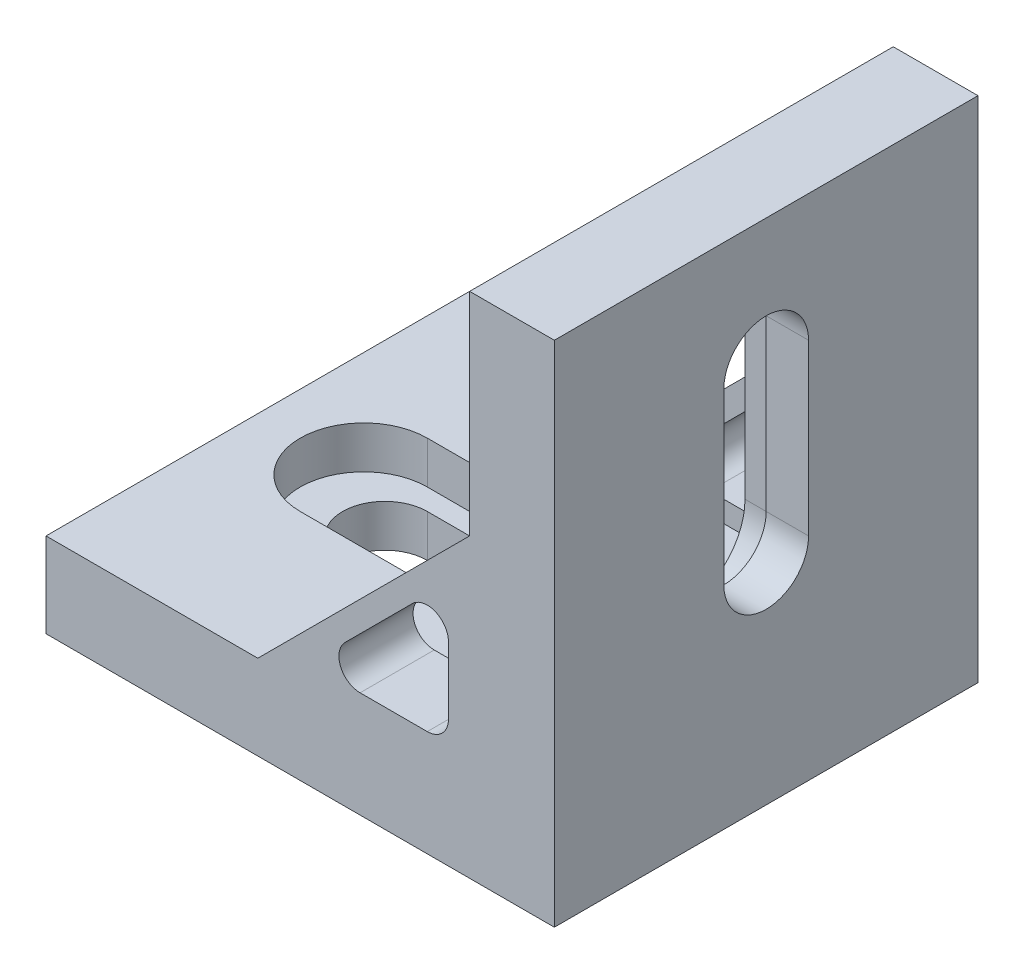
from build123d import *

# Parameters (mm, degrees)
SKETCH1_W            = 20
SKETCH1_H            = 20
BOSS_EXTRUDE1_DEPTH  = 4
CUT_EXTRUDE1_DEPTH   = 2
SKETCH4_W            = 20
SKETCH4_H            = 4
BOSS_EXTRUDE2_DEPTH  = 4
SKETCH5_W            = 4
SKETCH5_H            = 20
BOSS_EXTRUDE3_DEPTH  = 20
CUT_EXTRUDE2_DEPTH   = 2
CUT_EXTRUDE3_DEPTH   = 2
EXTRUDE_THIN2_DEPTH  = 3.5
FILLET1_R            = 1
FILLET1_OF_MIRROR3_R = 1


with BuildPart() as part:
    # Sketch1 → Boss-Extrude1 (new body)
    with BuildSketch(Plane(origin=(0, 0, 0), x_dir=(1, 0, 0), z_dir=(0, 1, 0))):
        Rectangle(SKETCH1_W, SKETCH1_H)
        with BuildLine():
            Line((-4, 2), (4, 2))
            ThreePointArc((4, 2), (6, 0), (4, -2))
            Line((4, -2), (-4, -2))
            ThreePointArc((-4, -2), (-6, 0), (-4, 2))
        make_face(mode=Mode.SUBTRACT)
    extrude(amount=BOSS_EXTRUDE1_DEPTH)

    # Sketch3 → Cut-Extrude1 (cut)
    with BuildSketch(Plane(origin=(0, 4, 0), x_dir=(1, 0, 0), z_dir=(0, 1, 0))):
        with BuildLine():
            Line((-5, 3), (5, 3))
            ThreePointArc((5, 3), (8, 0), (5, -3))
            Line((5, -3), (-5, -3))
            ThreePointArc((-5, -3), (-8, 0), (-5, 3))
        make_face()
    extrude(amount=-CUT_EXTRUDE1_DEPTH, mode=Mode.SUBTRACT)

    # Sketch4 → Boss-Extrude2 (add)
    with BuildSketch(Plane(origin=(10, 0, 0), x_dir=(0, 0, -1), z_dir=(1, 0, 0))):
        with Locations((0, 2)):
            Rectangle(SKETCH4_W, SKETCH4_H)
    extrude(amount=BOSS_EXTRUDE2_DEPTH)

    # Sketch5 → Boss-Extrude3 (add)
    with BuildSketch(Plane(origin=(0, 4, 0), x_dir=(1, 0, 0), z_dir=(0, 1, 0))):
        with Locations((12, 0)):
            Rectangle(SKETCH5_W, SKETCH5_H)
    extrude(amount=BOSS_EXTRUDE3_DEPTH)

    # Sketch6 → Cut-Extrude2 (cut)
    with BuildSketch(Plane.ZY.offset(-10)):
        with BuildLine():
            Line((-3, 9), (-3, 19))
            ThreePointArc((-3, 19), (0, 22), (3, 19))
            Line((3, 19), (3, 9))
            ThreePointArc((3, 9), (0, 6), (-3, 9))
        make_face()
    extrude(amount=-CUT_EXTRUDE2_DEPTH, mode=Mode.SUBTRACT)

    # Sketch7 → Cut-Extrude3 (cut)
    with BuildSketch(Plane.ZY.offset(-12)):
        with BuildLine():
            Line((-2, 10), (-2, 18))
            ThreePointArc((-2, 18), (0, 20), (2, 18))
            Line((2, 18), (2, 10))
            ThreePointArc((2, 10), (0, 8), (-2, 10))
        make_face()
    extrude(amount=-CUT_EXTRUDE3_DEPTH, mode=Mode.SUBTRACT)

    # Sketch17 → Extrude-Thin2 (add)
    with BuildSketch(Plane.XY.offset(-6.5)):
        Polygon((10, 4), (0, 4), (10, 14), align=None)
        Polygon((9, 5), (2.414213562, 5), (9, 11.585786438), align=None, mode=Mode.SUBTRACT)
    extrude_thin2 = extrude(amount=-EXTRUDE_THIN2_DEPTH)

    # Fillet1
    fillet1_edges = [part.edges().sort_by_distance(p)[0] for p in [
        (9, 5, -8.25),
        (2.414213562, 5, -8.25),
        (9, 11.585786438, -8.25),
    ]]
    fillet(fillet1_edges, radius=FILLET1_R)

    # Mirror3: Extrude-Thin2 across plane
    add(extrude_thin2.mirror(Plane.XY))

    # Fillet1 of Mirror3
    fillet1_of_mirror3_edges = [part.edges().sort_by_distance(p)[0] for p in [
        (9, 5, 8.25),
        (2.414213562, 5, 8.25),
        (9, 11.585786438, 8.25),
    ]]
    fillet(fillet1_of_mirror3_edges, radius=FILLET1_OF_MIRROR3_R)


solid = part.part
